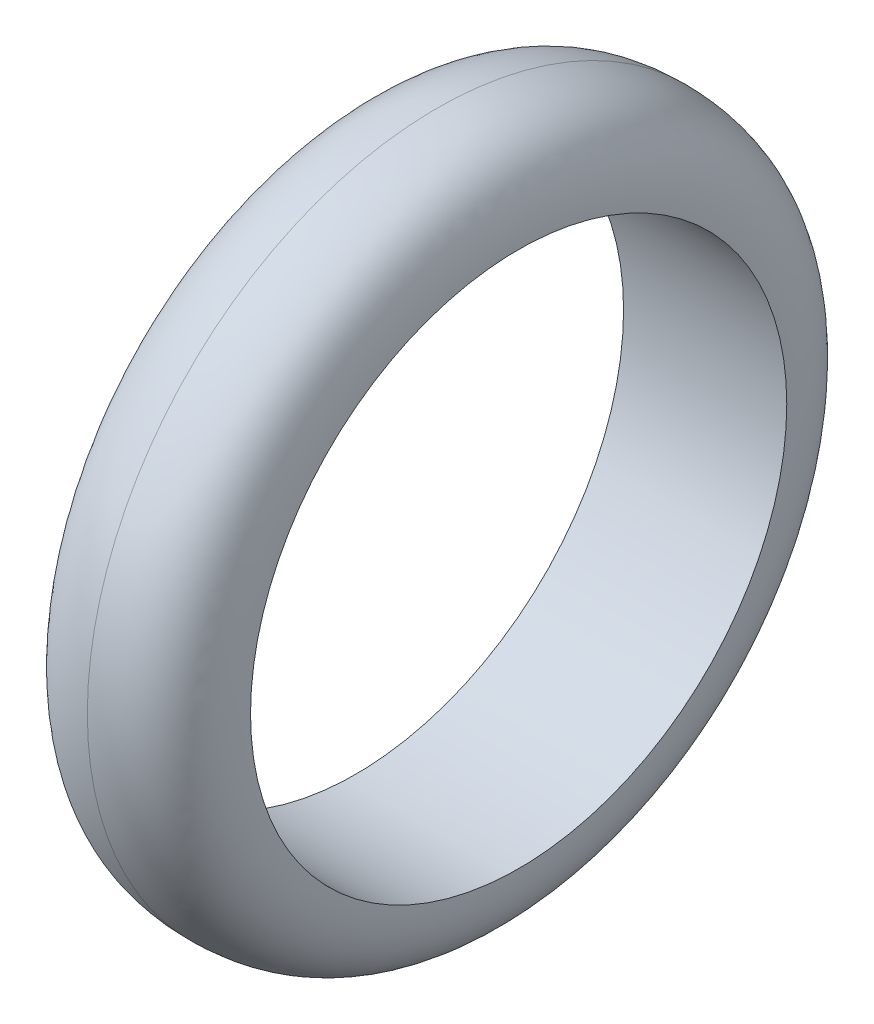
from build123d import *


with BuildPart() as part:
    # Sketch1 → Revolve1 (revolve)
    with BuildSketch(Plane.XY, mode=Mode.PRIVATE) as revolve1_sk:
        with BuildLine():
            Line((-8.89, 29.21), (8.89, 29.21))
            add(Edge.make_bspline(
                [(8.89, 29.21), (8.89, 38.1), (0, 38.1)],
                knots=[0, 0, 0, 1, 1, 1], degree=2))
            add(Edge.make_bspline(
                [(-8.89, 29.21), (-8.89, 38.1), (0, 38.1)],
                knots=[0, 0, 0, 1, 1, 1], degree=2))
        make_face()
    revolve(revolve1_sk.sketch.rotate(Axis((0, 0, 0), (1, 0, 0)), 90), axis=Axis((0, 0, 0), (1, 0, 0)))


solid = part.part
